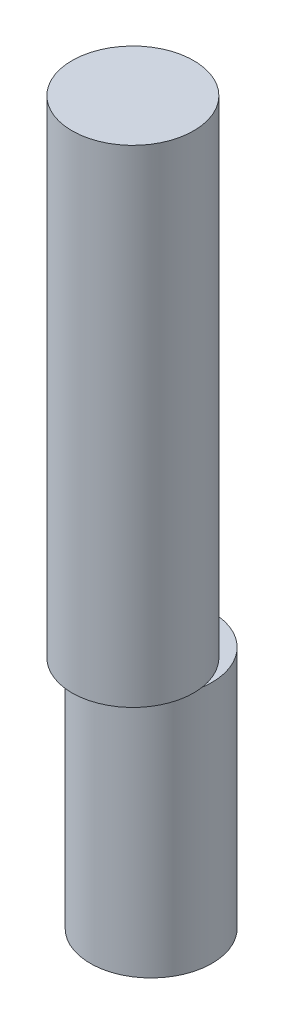
from build123d import *

# Parameters (mm, degrees)
SKETCH1_R           = 6.35
BOSS_EXTRUDE1_DEPTH = 50.8
SKETCH3_R           = 6.35
BOSS_EXTRUDE2_DEPTH = 25.4


with BuildPart() as part:
    # Sketch1 → Boss-Extrude1 (new body)
    with BuildSketch(Plane(origin=(0, 0, 0), x_dir=(1, 0, 0), z_dir=(0, 1, 0))):
        with Locations(Location((0, 0, 0), (0, 0, 270))):
            Circle(SKETCH1_R)
    extrude(amount=BOSS_EXTRUDE1_DEPTH)

    # Sketch3 → Boss-Extrude2 (add)
    with BuildSketch(Plane.XZ):
        with Locations(Location((0, -1.905, 0), (0, 0, 171.373073441))):
            Circle(SKETCH3_R)
    extrude(amount=BOSS_EXTRUDE2_DEPTH)


solid = part.part
